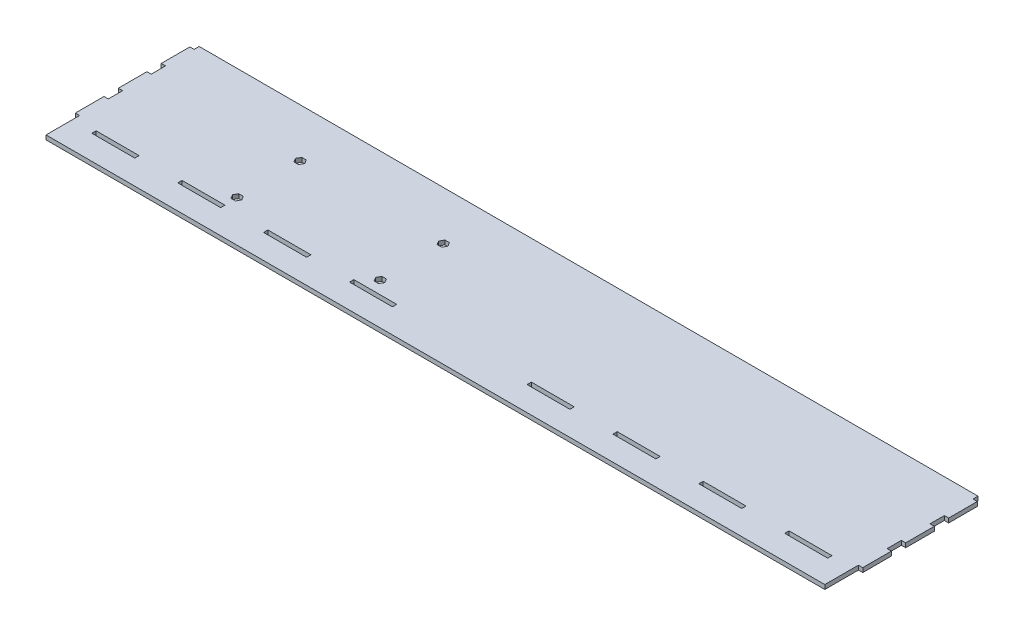
from build123d import *

# Parameters (mm, degrees)
SKETCH1_W           = 544
SKETCH1_H           = 107
BOSS_EXTRUDE1_DEPTH = 3
SKETCH2_W           = 30
SKETCH2_H           = 3
CUT_EXTRUDE1_DEPTH  = 3
CUT_EXTRUDE2_DEPTH  = 3
SKETCH5_W           = 3
SKETCH5_H           = 20
BOSS_EXTRUDE2_DEPTH = 3


with BuildPart() as part:
    # Sketch1 → Boss-Extrude1 (new body)
    with BuildSketch(Plane(origin=(0, 0, 0), x_dir=(1, 0, 0), z_dir=(0, 1, 0))):
        Rectangle(SKETCH1_W, SKETCH1_H)
    extrude(amount=BOSS_EXTRUDE1_DEPTH)

    # Sketch2 → Cut-Extrude1 (cut)
    with BuildSketch(Plane(origin=(0, 3, 0), x_dir=(1, 0, 0), z_dir=(0, 1, 0))):
        with Locations((62, -35)):
            Rectangle(SKETCH2_W, SKETCH2_H)
        with Locations((122, -35)):
            Rectangle(SKETCH2_W, SKETCH2_H)
        with Locations((182, -35)):
            Rectangle(SKETCH2_W, SKETCH2_H)
        with Locations((242, -35)):
            Rectangle(SKETCH2_W, SKETCH2_H)
        with Locations((-62, -35)):
            Rectangle(SKETCH2_W, SKETCH2_H)
        with Locations((-122, -35)):
            Rectangle(SKETCH2_W, SKETCH2_H)
        with Locations((-182, -35)):
            Rectangle(SKETCH2_W, SKETCH2_H)
        with Locations((-242, -35)):
            Rectangle(SKETCH2_W, SKETCH2_H)
    extrude(amount=-CUT_EXTRUDE1_DEPTH, mode=Mode.SUBTRACT)

    # Sketch4 → Cut-Extrude2 (cut)
    with BuildSketch(Plane(origin=(0, 3, 0), x_dir=(1, 0, 0), z_dir=(0, 1, 0))):
        Polygon((-164.324573519, 19.5), (-165.91228676, 22.25), (-169.08771324, 22.25), (-170.675426481, 19.5), (-169.08771324, 16.75), (-165.91228676, 16.75), align=None)
        Polygon((-164.324573519, -24.5), (-165.91228676, -21.75), (-169.08771324, -21.75), (-170.675426481, -24.5), (-169.08771324, -27.25), (-165.91228676, -27.25), align=None)
        Polygon((-70.675426481, 19.5), (-69.08771324, 16.75), (-65.91228676, 16.75), (-64.324573519, 19.5), (-65.91228676, 22.25), (-69.08771324, 22.25), align=None)
        Polygon((-70.675426481, -24.5), (-69.08771324, -27.25), (-65.91228676, -27.25), (-64.324573519, -24.5), (-65.91228676, -21.75), (-69.08771324, -21.75), align=None)
    extrude(amount=-CUT_EXTRUDE2_DEPTH, mode=Mode.SUBTRACT)

    # Sketch5 → Boss-Extrude2 (add)
    with BuildSketch(Plane(origin=(0, 0, 0), x_dir=(1, 0, 0), z_dir=(0, 1, 0))):
        with Locations((-273.5, 10)):
            Rectangle(SKETCH5_W, SKETCH5_H)
        with Locations((-273.5, -20)):
            Rectangle(SKETCH5_W, SKETCH5_H)
        with Locations((-273.5, 40)):
            Rectangle(SKETCH5_W, SKETCH5_H)
    boss_extrude2 = extrude(amount=BOSS_EXTRUDE2_DEPTH)

    # Mirror1: Boss-Extrude2 across plane
    add(boss_extrude2.mirror(Plane(origin=(0, 0, 0), x_dir=(0, 0, 1), z_dir=(1, 0, 0))))


solid = part.part
